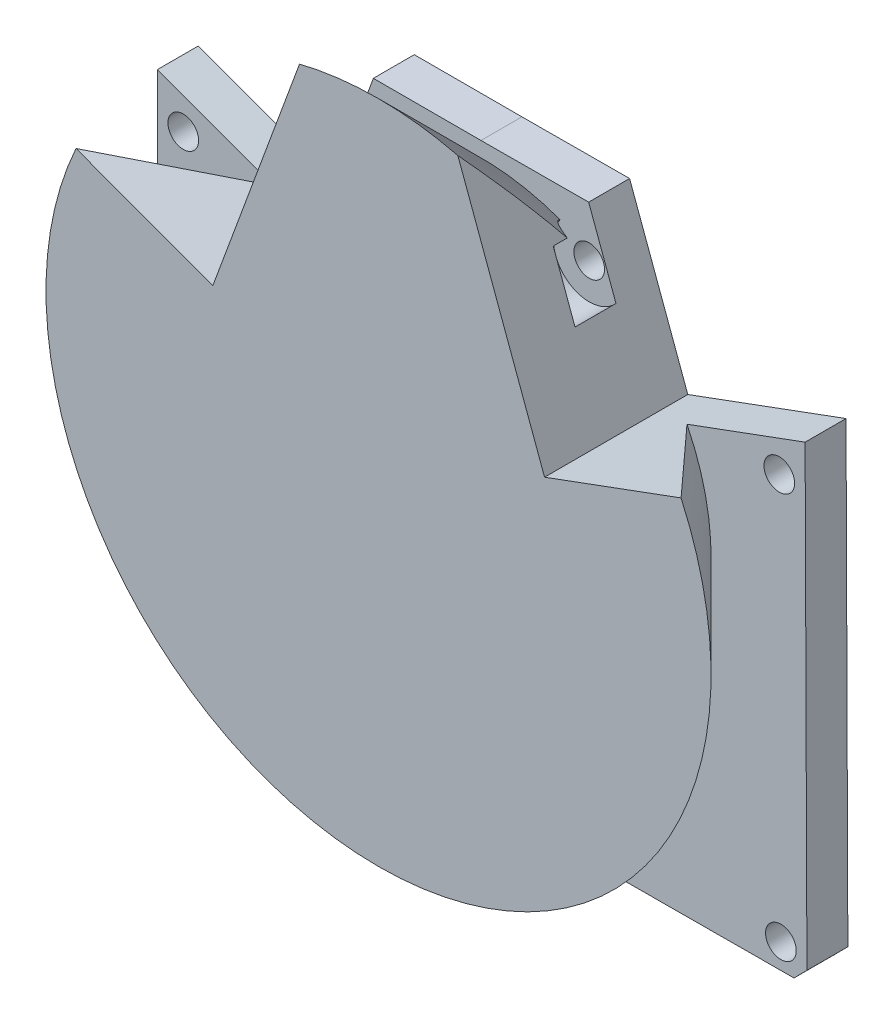
from build123d import *

# Parameters (mm, degrees)
SKETCH9_R           = 1.4986
BOSS_EXTRUDE2_DEPTH = 4
SKETCH10_R          = 22.5
BOSS_EXTRUDE3_DEPTH = 10
BOSS_EXTRUDE3_DRAFT = -45
CUT_EXTRUDE1_DEPTH  = 10
SKETCH12_R          = 3.4986
CUT_EXTRUDE2_DEPTH  = 4


with BuildPart() as part:
    # Sketch9 → Boss-Extrude2 (new body)
    with BuildSketch(Plane.XY):
        Polygon((0, 45.894331692), (15.488494665, 40.257085472), (21.11579715, 55.718259441), (31.638563481, 55.718259441), (42.161245631, 55.760350338), (47.850347546, 40.321809178), (63.316169409, 46.020964031), (63.494666021, 1.396989332), (62.229756161, 0.121919512), (31.75, 0), (1.27, 0), (0, 1.27), align=None)
        with Locations((60.94984, 2.54)):
            Circle(SKETCH9_R, mode=Mode.SUBTRACT)
        with Locations((21.082, 50.8)):
            Circle(SKETCH9_R, mode=Mode.SUBTRACT)
        with Locations((2.54, 41.91)):
            Circle(SKETCH9_R, mode=Mode.SUBTRACT)
        with Locations(Location((60.792126991, 42.026504254, 0), (0, 0, 180))):
            Circle(SKETCH9_R, mode=Mode.SUBTRACT)
        with Locations(Location((42.214715469, 50.842265431, 0), (0, 0, 180))):
            Circle(SKETCH9_R, mode=Mode.SUBTRACT)
        with Locations((2.45872, 20.32)):
            Circle(SKETCH9_R, mode=Mode.SUBTRACT)
    extrude(amount=BOSS_EXTRUDE2_DEPTH)


with BuildPart() as boss_extrude3_tool:
    # Sketch10 → Boss-Extrude3 (with draft: the straight prism first)
    with BuildSketch(Plane.XY.offset(4)):
        with Locations((31.623, 31.75)):
            Circle(SKETCH10_R)
    extrude(amount=BOSS_EXTRUDE3_DEPTH)
    # Boss-Extrude3: the draft: its side faces are tilted about the plane it starts from
    boss_extrude3_sides = [boss_extrude3_tool.faces().sort_by_distance(p)[0] for p in [
        (9.123, 31.75, 9),
    ]]
    draft(boss_extrude3_sides, Plane.XY.offset(4), BOSS_EXTRUDE3_DRAFT)


with BuildPart() as part_1:
    add(part.part)

    # Boss-Extrude3: add boss_extrude3_tool
    add(boss_extrude3_tool.part)

    # Sketch11 → Cut-Extrude1 (cut)
    with BuildSketch(Plane.XY.offset(4)):
        Polygon((63.316169409, 46.020964031), (54.671905515, 69.478941389), (39.206083653, 63.779786536), (42.161245631, 55.760350338), (47.850347546, 40.321809178), align=None)
        Polygon((-0.039042446, 46.020964031), (15.426779416, 40.321809178), (21.115881332, 55.760350338), (24.071043309, 63.779786536), (8.605221447, 69.478941389), align=None)
    extrude(amount=CUT_EXTRUDE1_DEPTH, mode=Mode.SUBTRACT)

    # Sketch12 → Cut-Extrude2 (cut)
    with BuildSketch(Plane.XY.offset(4)):
        with Locations((21.062411493, 50.842265431)):
            Circle(SKETCH12_R)
        with Locations((42.214715469, 50.842265431)):
            Circle(SKETCH12_R)
    extrude(amount=CUT_EXTRUDE2_DEPTH, mode=Mode.SUBTRACT)


solid = part_1.part
